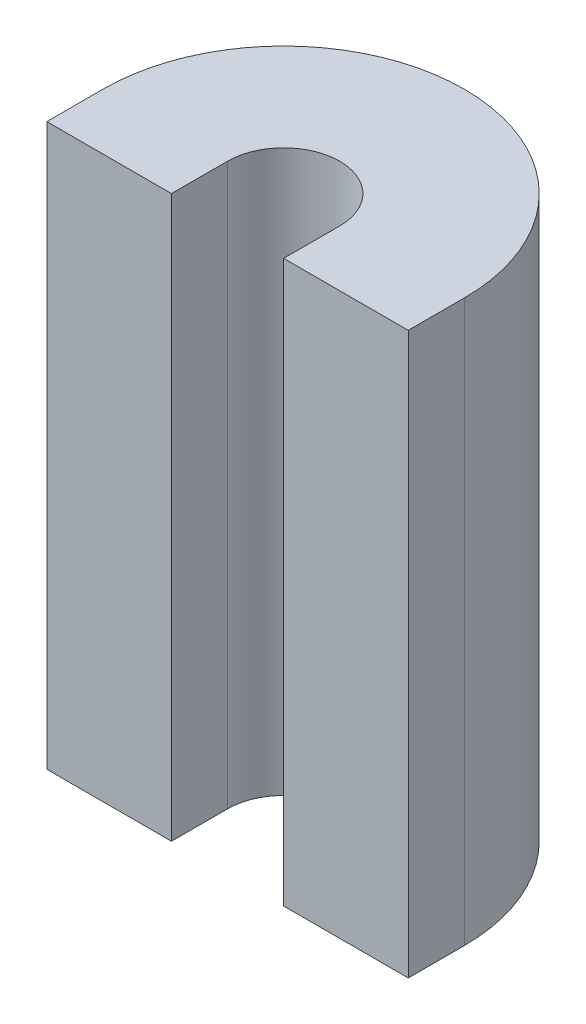
from build123d import *

# Parameters (mm, degrees)
BOSS_EXTRUDE1_DEPTH = 18


with BuildPart() as part:
    # Sketch3 → Boss-Extrude1 (new body)
    with BuildSketch(Plane(origin=(0, 0, 0), x_dir=(1, 0, 0), z_dir=(0, 1, 0))):
        with BuildLine():
            Line((-1.8, 0), (-5.8, 0))
            Line((-5.8, 0), (-5.8, 1.8))
            ThreePointArc((-5.8, 1.8), (-4.101219331, 5.901219331), (0, 7.6))
            ThreePointArc((0, 7.6), (4.101219331, 5.901219331), (5.8, 1.8))
            Line((5.8, 1.8), (5.8, 0))
            Line((5.8, 0), (1.8, 0))
            Line((1.8, 0), (1.8, 1.8))
            ThreePointArc((1.8, 1.8), (1.272792206, 3.072792206), (0, 3.6))
            ThreePointArc((0, 3.6), (-1.272792206, 3.072792206), (-1.8, 1.8))
            Line((-1.8, 1.8), (-1.8, 0))
        make_face()
    extrude(amount=BOSS_EXTRUDE1_DEPTH)


solid = part.part
